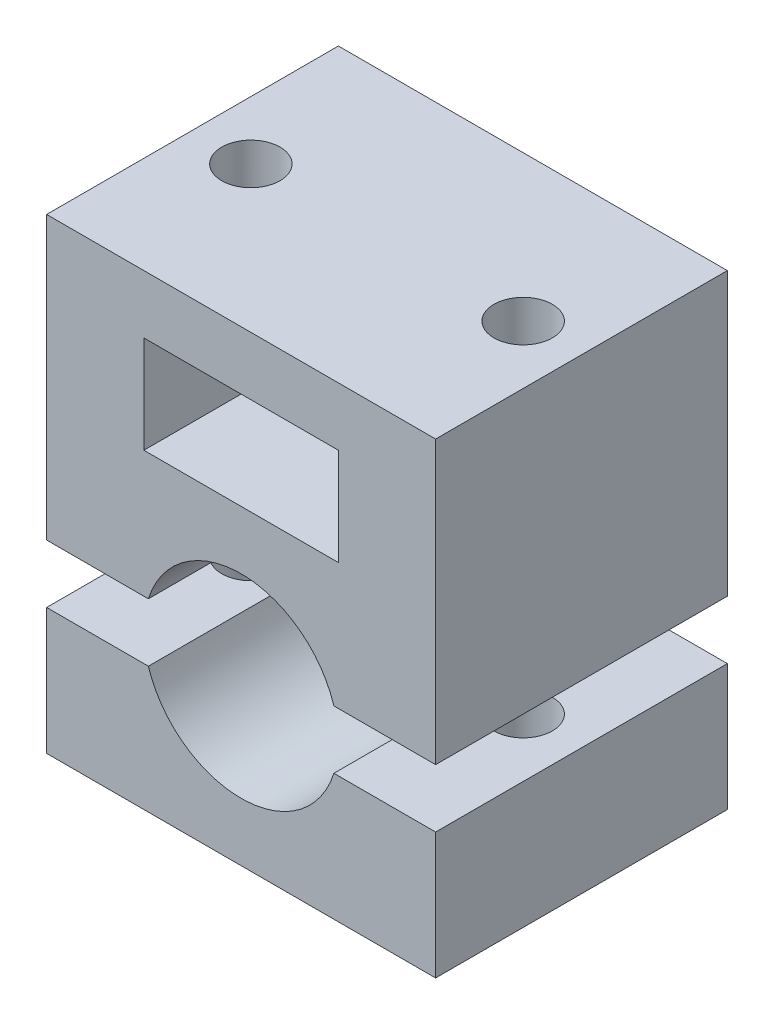
from build123d import *

# Parameters (mm, degrees)
SKETCH_1_W          = 10
SKETCH_1_H          = 5
EXTRUDE_1_DEPTH     = 15
EXTRUDE_1_2_DEPTH   = 15
SKETCH_2_R          = 1.5
CUT_EXTRUDE_1_DEPTH = 31.01666204


with BuildPart() as part:
    # 草图1 → 凸台-拉伸1 (new body)
    with BuildSketch(Plane.XY):
        with BuildLine():
            Line((-10, 1.5), (-4.769696007, 1.5))
            ThreePointArc((-4.769696007, 1.5), (0, 5), (4.769696007, 1.5))
            Line((4.769696007, 1.5), (10, 1.5))
            Line((10, 1.5), (10, 16))
            Line((10, 16), (-10, 16))
            Line((-10, 16), (-10, 1.5))
        make_face()
        with Locations((0, 10.5)):
            Rectangle(SKETCH_1_W, SKETCH_1_H, mode=Mode.SUBTRACT)
    extrude(amount=EXTRUDE_1_DEPTH)


with BuildPart() as body_2:
    # 草图1 → Extrude 1 2 (new body)
    with BuildSketch(Plane.XY):
        with BuildLine():
            Line((-10, -8), (10, -8))
            Line((10, -8), (10, -1.5))
            Line((10, -1.5), (4.769696007, -1.5))
            ThreePointArc((4.769696007, -1.5), (0, -5), (-4.769696007, -1.5))
            Line((-4.769696007, -1.5), (-10, -1.5))
            Line((-10, -1.5), (-10, -8))
        make_face()
    extrude(amount=EXTRUDE_1_2_DEPTH)


with BuildPart() as cut_extrude_1_tool:
    # 草图2 → 切除-拉伸1 (new, through all)
    with BuildSketch(Plane.XZ.offset(8)):
        with Locations((-7, 7.5)):
            Circle(SKETCH_2_R)
        with Locations((7, 7.5)):
            Circle(SKETCH_2_R)
    extrude(amount=-CUT_EXTRUDE_1_DEPTH)


with BuildPart() as part_1:
    add(part.part)

    # 切除-拉伸1: cut by cut_extrude_1_tool
    add(cut_extrude_1_tool.part, mode=Mode.SUBTRACT)


with BuildPart() as body_2_1:
    add(body_2.part)

    # 切除-拉伸1: cut by cut_extrude_1_tool
    add(cut_extrude_1_tool.part, mode=Mode.SUBTRACT)


solid = Compound([part_1.part, body_2_1.part])
